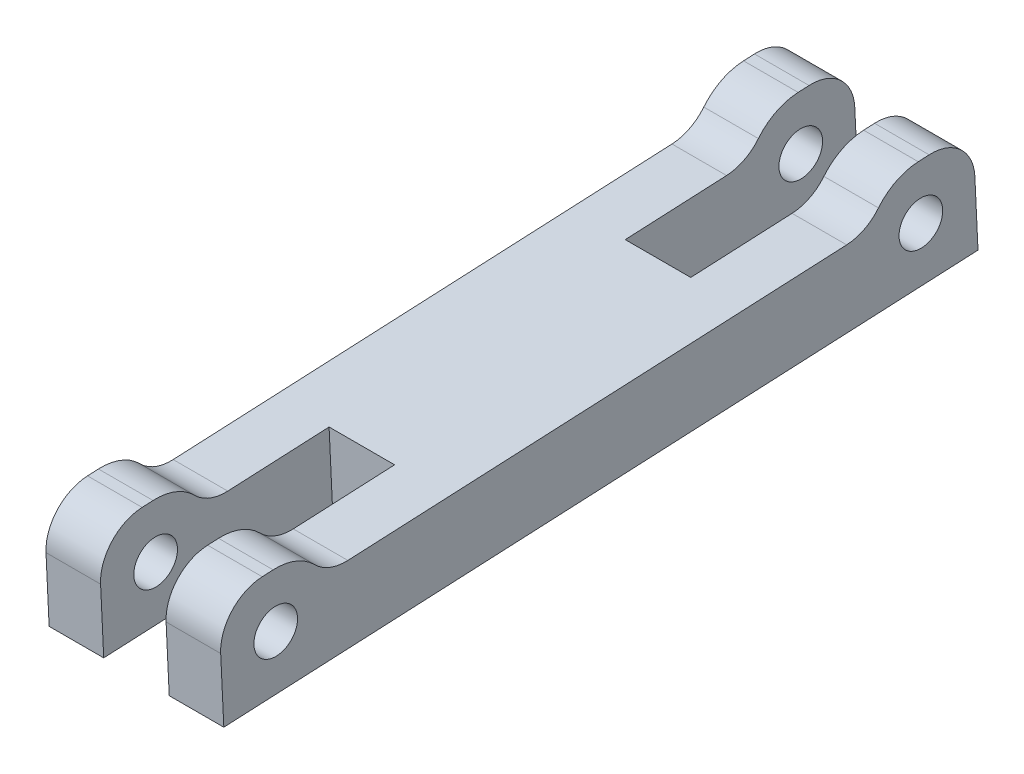
from build123d import *

# Parameters (mm, degrees)
BOSS_EXTRUDE1_DEPTH      = 1.5
BOSS_EXTRUDE1_DEPTH_BACK = 1.5
BOSS_EXTRUDE2_START      = 1.5
SKETCH1_3_R              = 1
BOSS_EXTRUDE2_DEPTH      = 2.5
BOSS_EXTRUDE3_START      = -4
SKETCH1_4_R              = 1
BOSS_EXTRUDE3_DEPTH      = 2.5
FILLET1_R                = 2
CUT_EXTRUDE1_DEPTH       = 41.943081007
CUT_EXTRUDE1_DEPTH_BACK  = 41.943081007
FILLET2_R                = 2


with BuildPart() as part:
    # Sketch1 → Boss-Extrude1 (new, two sides: drawn at the far end of the back side and taken through both)
    with BuildSketch(Plane(origin=(0, 0, 0), x_dir=(0, 0, -1), z_dir=(1, 0, 0)).offset(-BOSS_EXTRUDE1_DEPTH_BACK)):
        Polygon((14.942385879, 9.950712214), (15.181450651, 4.95643068), (28.743963307, 5.605636972), (28.504898535, 10.599918506), align=None)
    extrude(amount=BOSS_EXTRUDE1_DEPTH + BOSS_EXTRUDE1_DEPTH_BACK)

    # Sketch1<3> → Boss-Extrude2 (add)
    with BuildSketch(Plane(origin=(0, 0, 0), x_dir=(0, 0, -1), z_dir=(1, 0, 0)).offset(BOSS_EXTRUDE2_START)):
        Polygon((4.454394659, 9.448676193), (4.693459431, 4.454394659), (39.231954527, 6.107672994), (38.992889755, 11.101954527), align=None)
        with Locations((7.071067812, 7.071067812)):
            Circle(SKETCH1_3_R, mode=Mode.SUBTRACT)
        with Locations((36.615281374, 8.485281374)):
            Circle(SKETCH1_3_R, mode=Mode.SUBTRACT)
    extrude(amount=BOSS_EXTRUDE2_DEPTH)

    # Sketch1<4> → Boss-Extrude3 (add)
    with BuildSketch(Plane(origin=(0, 0, 0), x_dir=(0, 0, -1), z_dir=(1, 0, 0)).offset(BOSS_EXTRUDE3_START)):
        Polygon((4.454394659, 9.448676193), (4.693459431, 4.454394659), (39.231954527, 6.107672994), (38.992889755, 11.101954527), align=None)
        with Locations((7.071067812, 7.071067812)):
            Circle(SKETCH1_4_R, mode=Mode.SUBTRACT)
        with Locations((36.615281374, 8.485281374)):
            Circle(SKETCH1_4_R, mode=Mode.SUBTRACT)
    extrude(amount=BOSS_EXTRUDE3_DEPTH)

    # Fillet1
    fillet1_edges = [part.edges().sort_by_distance(p)[0] for p in [
        (2.75, 11.101954527, -38.992889755),
        (-2.75, 11.101954527, -38.992889755),
        (2.75, 9.448676193, -4.454394659),
        (-2.75, 9.448676193, -4.454394659),
    ]]
    fillet(fillet1_edges, radius=FILLET1_R)

    # Sketch3 → Cut-Extrude1 (cut, two sides: drawn at the far end of the back side and taken through both)
    with BuildSketch(Plane(origin=(0, 0, 0), x_dir=(0, 0, -1), z_dir=(1, 0, 0)).offset(-CUT_EXTRUDE1_DEPTH_BACK)):
        with BuildLine():
            ThreePointArc((6.951535426, 9.568208579), (8.33880017, 9.225796256), (9.311922174, 8.17947736))
            Line((9.311922174, 8.17947736), (34.278801103, 9.37458444))
            ThreePointArc((34.278801103, 9.37458444), (35.147533078, 10.50906865), (36.495748988, 10.982422141))
            Line((36.495748988, 10.982422141), (36.350334975, 14.020253749))
            Line((36.350334975, 14.020253749), (6.806121413, 12.606040186))
            Line((6.806121413, 12.606040186), (6.951535426, 9.568208579))
        make_face()
    extrude(amount=CUT_EXTRUDE1_DEPTH + CUT_EXTRUDE1_DEPTH_BACK, mode=Mode.SUBTRACT)

    # Fillet2
    fillet2_edges = [part.edges().sort_by_distance(p)[0] for p in [
        (2.75, 9.37458444, -34.278801103),
        (-2.75, 9.37458444, -34.278801103),
        (2.75, 8.17947736, -9.311922174),
        (-2.75, 8.17947736, -9.311922174),
    ]]
    fillet(fillet2_edges, radius=FILLET2_R)


solid = part.part
